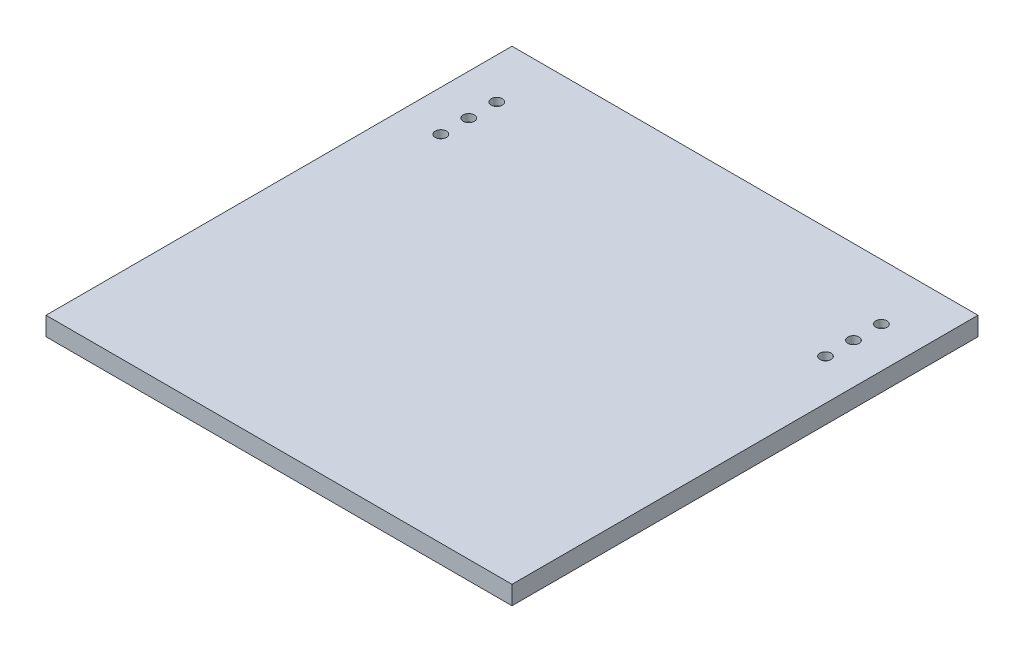
from build123d import *

# Parameters (mm, degrees)
SKETCH1_W                             = 125
SKETCH1_H                             = 125
BOSS_EXTRUDE1_DEPTH                   = 5
SKETCH2_R                             = 1.5
CUT_EXTRUDE1_DEPTH                    = 2
TAP_DRILL_FOR_M2X0_4_TAP1_D           = 1.6
TAP_DRILL_FOR_M2X0_4_TAP1_CSINK_D     = 1.65
TAP_DRILL_FOR_M2X0_4_TAP1_CSINK_ANGLE = 90


with BuildPart() as part:
    # Sketch1 → Boss-Extrude1 (new body)
    with BuildSketch(Plane(origin=(0, 0, 0), x_dir=(1, 0, 0), z_dir=(0, 1, 0))):
        with Locations((62.5, 62.5)):
            Rectangle(SKETCH1_W, SKETCH1_H)
    extrude(amount=BOSS_EXTRUDE1_DEPTH)

    # Sketch2 → Cut-Extrude1 (cut)
    with BuildSketch(Plane(origin=(0, 5, 0), x_dir=(1, 0, 0), z_dir=(0, 1, 0))):
        with Locations(Location((10.91, 95, 0), (0, 0, 270))):
            Circle(SKETCH2_R)
        with Locations(Location((10.91, 110, 0), (0, 0, 270))):
            Circle(SKETCH2_R)
        with Locations(Location((114.09, 110, 0), (0, 0, 270))):
            Circle(SKETCH2_R)
        with Locations(Location((114.09, 95, 0), (0, 0, 270))):
            Circle(SKETCH2_R)
        with Locations(Location((114.09, 102.5, 0), (0, 0, 270))):
            Circle(SKETCH2_R)
        with Locations(Location((10.91, 102.5, 0), (0, 0, 270))):
            Circle(SKETCH2_R)
    extrude(amount=-CUT_EXTRUDE1_DEPTH, mode=Mode.SUBTRACT)

    # Tap Drill for M2x0.4 Tap1 (through all)
    with Locations(Plane(origin=(0, 5, 0), x_dir=(1, 0, 0), z_dir=(0, 1, 0))):
        with Locations((10.91, 95), (10.91, 110), (114.09, 110), (114.09, 95), (10.91, 102.5), (114.09, 102.5)):
            CounterSinkHole(TAP_DRILL_FOR_M2X0_4_TAP1_D / 2, TAP_DRILL_FOR_M2X0_4_TAP1_CSINK_D / 2, counter_sink_angle=TAP_DRILL_FOR_M2X0_4_TAP1_CSINK_ANGLE)


solid = part.part
